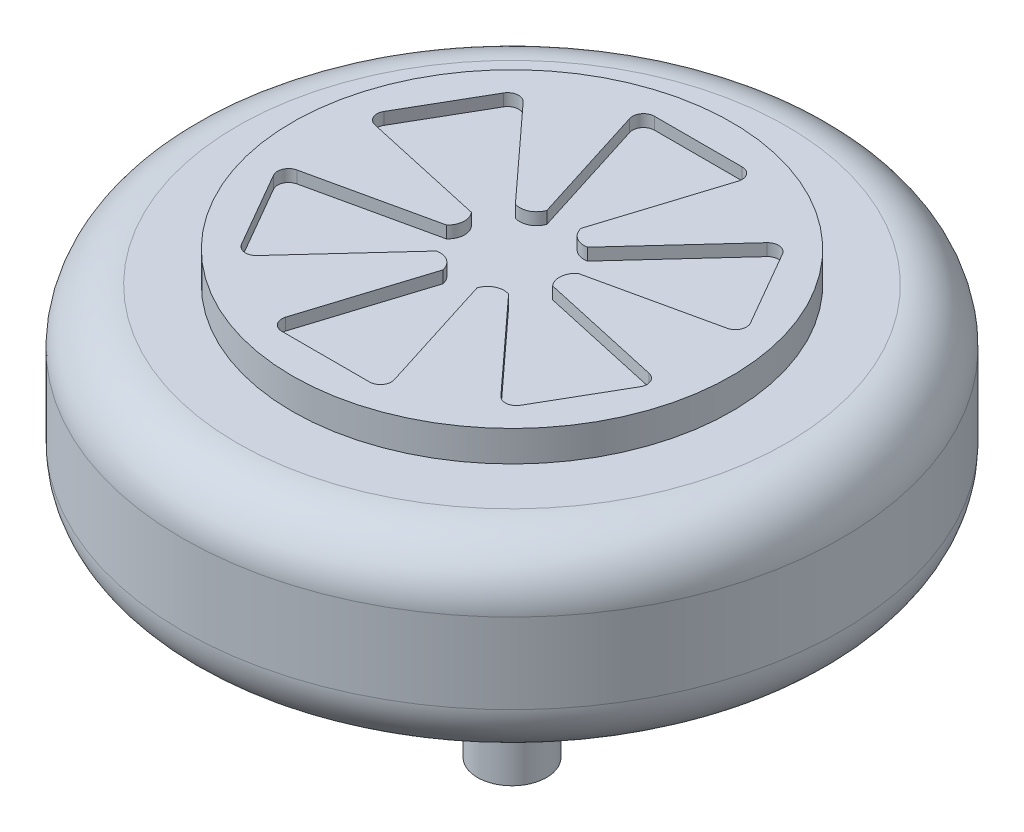
from build123d import *

# Parameters (mm, degrees)
SKETCH3_R           = 76.2
SKETCH3_R_2         = 34.29
BOSS_EXTRUDE1_DEPTH = 43.942
SKETCH4_R           = 41.021
CUT_EXTRUDE1_DEPTH  = 3.556
FILLET1_R           = 12.7
SKETCH5_R           = 50.8
BOSS_EXTRUDE2_DEPTH = 7.112
SKETCH7_R           = 44.45
BOSS_EXTRUDE3_DEPTH = 7.366
CUT_EXTRUDE2_DEPTH  = 2.794
BOSS_EXTRUDE5_DEPTH = 41.91
SKETCH11_R          = 41.021
BOSS_EXTRUDE6_DEPTH = 4.318
SKETCH12_R          = 8
BOSS_EXTRUDE7_DEPTH = 50


with BuildPart() as part:
    # Sketch3 → Boss-Extrude1 (new body)
    with BuildSketch(Plane(origin=(0, 0, 0), x_dir=(1, 0, 0), z_dir=(0, 1, 0))):
        with Locations(Location((0, 0, 0), (0, 0, 90))):
            Circle(SKETCH3_R)
        with Locations(Location((0, 0, 0), (0, 0, 90))):
            Circle(SKETCH3_R_2, mode=Mode.SUBTRACT)
    extrude(amount=BOSS_EXTRUDE1_DEPTH)

    # Sketch4 → Cut-Extrude1 (cut)
    with BuildSketch(Plane(origin=(0, 43.942, 0), x_dir=(1, 0, 0), z_dir=(0, 1, 0))):
        with Locations(Location((0, 0, 0), (0, 0, 270))):
            Circle(SKETCH4_R)
    cut_extrude1 = extrude(amount=-CUT_EXTRUDE1_DEPTH, mode=Mode.SUBTRACT)

    # Mirror1: Cut-Extrude1 across plane
    add(cut_extrude1.mirror(Plane.ZX.offset(21.971)), mode=Mode.SUBTRACT)

    # Fillet1
    fillet1_edges = [part.edges().sort_by_distance(p)[0] for p in [
        (0, 0, 76.2),
        (0, 43.942, 76.2),
    ]]
    fillet(fillet1_edges, radius=FILLET1_R)



with BuildPart() as body_2:
    # Sketch5 → Boss-Extrude2 (new body)
    with BuildSketch(Plane(origin=(0, 43.942, 0), x_dir=(1, 0, 0), z_dir=(0, 1, 0))):
        with Locations(Location((0, 0, 0), (0, 0, 270))):
            Circle(SKETCH5_R)
    extrude(amount=BOSS_EXTRUDE2_DEPTH)

    # Sketch7 → Boss-Extrude3 (add)
    with BuildSketch(Plane(origin=(0, 51.054, 0), x_dir=(1, 0, 0), z_dir=(0, 1, 0))):
        with Locations(Location((0, 0, 0), (0, 0, 270))):
            Circle(SKETCH7_R)
    extrude(amount=-BOSS_EXTRUDE3_DEPTH)

    # Sketch8 → Cut-Extrude2 (cut)
    with BuildSketch(Plane(origin=(0, 51.054, 0), x_dir=(1, 0, 0), z_dir=(0, 1, 0))):
        with BuildLine():
            Line((-3.717986915, 11.786271444), (-12.545239758, 39.769263451))
            ThreePointArc((-12.545239758, 39.769263451), (-12.171377231, 42.035175802), (-10.12290422, 43.073390757))
            Line((-10.12290422, 43.073390757), (10.12290422, 43.073390757))
            ThreePointArc((10.12290422, 43.073390757), (12.171377231, 42.035175802), (12.545239758, 39.769263451))
            Line((12.545239758, 39.769263451), (3.832946747, 12.150701932))
            ThreePointArc((3.832946747, 12.150701932), (5.461454635, 9.696711292), (8.348217029, 9.113006841))
            Line((8.348217029, 9.113006841), (28.16857256, 30.749128053))
            ThreePointArc((28.16857256, 30.749128053), (30.317841482, 31.558309782), (32.241198512, 30.303387593))
            Line((32.241198512, 30.303387593), (42.364102732, 12.770003164))
            ThreePointArc((42.364102732, 12.770003164), (42.489218712, 10.47686602), (40.713812318, 9.020135398))
            Line((40.713812318, 9.020135398), (12.43928992, 2.755921712))
            ThreePointArc((12.43928992, 2.755921712), (11.12832563, 0.11859719), (12.066203944, -2.673264603))
            Line((12.066203944, -2.673264603), (40.713812318, -9.020135398))
            ThreePointArc((40.713812318, -9.020135398), (42.489218712, -10.47686602), (42.364102732, -12.770003164))
            Line((42.364102732, -12.770003164), (32.241198512, -30.303387593))
            ThreePointArc((32.241198512, -30.303387593), (30.317841482, -31.558309782), (28.16857256, -30.749128053))
            Line((28.16857256, -30.749128053), (8.606343173, -9.39478022))
            ThreePointArc((8.606343173, -9.39478022), (5.666870994, -9.578114102), (3.717986915, -11.786271444))
            Line((3.717986915, -11.786271444), (12.545239758, -39.769263451))
            ThreePointArc((12.545239758, -39.769263451), (12.171377231, -42.035175802), (10.12290422, -43.073390757))
            Line((10.12290422, -43.073390757), (-10.12290422, -43.073390757))
            ThreePointArc((-10.12290422, -43.073390757), (-12.171377231, -42.035175802), (-12.545239758, -39.769263451))
            Line((-12.545239758, -39.769263451), (-3.832946747, -12.150701932))
            ThreePointArc((-3.832946747, -12.150701932), (-5.461454635, -9.696711292), (-8.348217029, -9.113006841))
            Line((-8.348217029, -9.113006841), (-28.16857256, -30.749128053))
            ThreePointArc((-28.16857256, -30.749128053), (-30.317841482, -31.558309782), (-32.241198512, -30.303387593))
            Line((-32.241198512, -30.303387593), (-42.364102732, -12.770003164))
            ThreePointArc((-42.364102732, -12.770003164), (-42.489218712, -10.47686602), (-40.713812318, -9.020135398))
            Line((-40.713812318, -9.020135398), (-12.43928992, -2.755921712))
            ThreePointArc((-12.43928992, -2.755921712), (-11.12832563, -0.11859719), (-12.066203944, 2.673264603))
            Line((-12.066203944, 2.673264603), (-40.713812318, 9.020135398))
            ThreePointArc((-40.713812318, 9.020135398), (-42.489218712, 10.47686602), (-42.364102732, 12.770003164))
            Line((-42.364102732, 12.770003164), (-32.241198512, 30.303387593))
            ThreePointArc((-32.241198512, 30.303387593), (-30.317841482, 31.558309782), (-28.16857256, 30.749128053))
            Line((-28.16857256, 30.749128053), (-8.606343173, 9.39478022))
            ThreePointArc((-8.606343173, 9.39478022), (-5.666870994, 9.578114102), (-3.717986915, 11.786271444))
        make_face()
    extrude(amount=-CUT_EXTRUDE2_DEPTH, mode=Mode.SUBTRACT)


with BuildPart() as part_1:
    add(part.part)

    add(body_2.part)  # Boss-Extrude5 merges body 2
    # Sketch10 → Boss-Extrude5 (add)
    with BuildSketch(Plane(origin=(0, 48.26, 0), x_dir=(1, 0, 0), z_dir=(0, 1, 0))):
        with BuildLine():
            Line((10.12290422, 45.613390757), (-10.12290422, 45.613390757))
            ThreePointArc((-10.12290422, 45.613390757), (-14.219850242, 43.536960847), (-14.967575297, 39.005136146))
            Line((-14.967575297, 39.005136146), (-6.471688132, 12.072595881))
            ThreePointArc((-6.471688132, 12.072595881), (-6.854928199, 11.827206148), (-7.29904471, 11.727961017))
            Line((-7.29904471, 11.727961017), (-26.295651132, 32.464868513))
            ThreePointArc((-26.295651132, 32.464868513), (-30.594188976, 34.083231971), (-34.440903038, 31.573387593))
            Line((-34.440903038, 31.573387593), (-44.563807258, 14.040003164))
            ThreePointArc((-44.563807258, 14.040003164), (-44.814039218, 9.453728876), (-41.263226429, 6.540267633))
            Line((-41.263226429, 6.540267633), (-13.691018788, 0.431651613))
            ThreePointArc((-13.691018788, 0.431651613), (-13.67012508, -0.022938888), (-13.80623453, -0.457177633))
            Line((-13.80623453, -0.457177633), (-41.263226429, -6.540267633))
            ThreePointArc((-41.263226429, -6.540267633), (-44.814039218, -9.453728876), (-44.563807258, -14.040003164))
            Line((-44.563807258, -14.040003164), (-34.440903038, -31.573387593))
            ThreePointArc((-34.440903038, -31.573387593), (-30.594188976, -34.083231971), (-26.295651132, -32.464868513))
            Line((-26.295651132, -32.464868513), (-7.219330657, -11.640944268))
            ThreePointArc((-7.219330657, -11.640944268), (-6.81519688, -11.850145036), (-6.507189821, -12.185138651))
            Line((-6.507189821, -12.185138651), (-14.967575297, -39.005136146))
            ThreePointArc((-14.967575297, -39.005136146), (-14.219850242, -43.536960847), (-10.12290422, -45.613390757))
            Line((-10.12290422, -45.613390757), (10.12290422, -45.613390757))
            ThreePointArc((10.12290422, -45.613390757), (14.219850242, -43.536960847), (14.967575297, -39.005136146))
            Line((14.967575297, -39.005136146), (6.471688132, -12.072595881))
            ThreePointArc((6.471688132, -12.072595881), (6.854928199, -11.827206148), (7.29904471, -11.727961017))
            Line((7.29904471, -11.727961017), (26.295651132, -32.464868513))
            ThreePointArc((26.295651132, -32.464868513), (30.594188976, -34.083231971), (34.440903038, -31.573387593))
            Line((34.440903038, -31.573387593), (44.563807258, -14.040003164))
            ThreePointArc((44.563807258, -14.040003164), (44.814039218, -9.453728876), (41.263226429, -6.540267633))
            Line((41.263226429, -6.540267633), (13.691018788, -0.431651613))
            ThreePointArc((13.691018788, -0.431651613), (13.67012508, 0.022938888), (13.80623453, 0.457177633))
            Line((13.80623453, 0.457177633), (41.263226429, 6.540267633))
            ThreePointArc((41.263226429, 6.540267633), (44.814039218, 9.453728876), (44.563807258, 14.040003164))
            Line((44.563807258, 14.040003164), (34.440903038, 31.573387593))
            ThreePointArc((34.440903038, 31.573387593), (30.594188976, 34.083231971), (26.295651132, 32.464868513))
            Line((26.295651132, 32.464868513), (7.219330657, 11.640944268))
            ThreePointArc((7.219330657, 11.640944268), (6.81519688, 11.850145036), (6.507189821, 12.185138651))
            Line((6.507189821, 12.185138651), (14.967575297, 39.005136146))
            ThreePointArc((14.967575297, 39.005136146), (14.219850242, 43.536960847), (10.12290422, 45.613390757))
        make_face()
    extrude(amount=-BOSS_EXTRUDE5_DEPTH)

    # Sketch11 → Boss-Extrude6 (add)
    with BuildSketch(Plane.XZ.offset(-3.556)):
        with Locations(Location((0, 0, 0), (0, 0, 90))):
            Circle(SKETCH11_R)
    extrude(amount=BOSS_EXTRUDE6_DEPTH)

    # Sketch12 → Boss-Extrude7 (add)
    with BuildSketch(Plane.XZ.offset(0.762)):
        with Locations(Location((0, 0, 0), (0, 0, 270))):
            Circle(SKETCH12_R)
    extrude(amount=BOSS_EXTRUDE7_DEPTH)


solid = part_1.part
